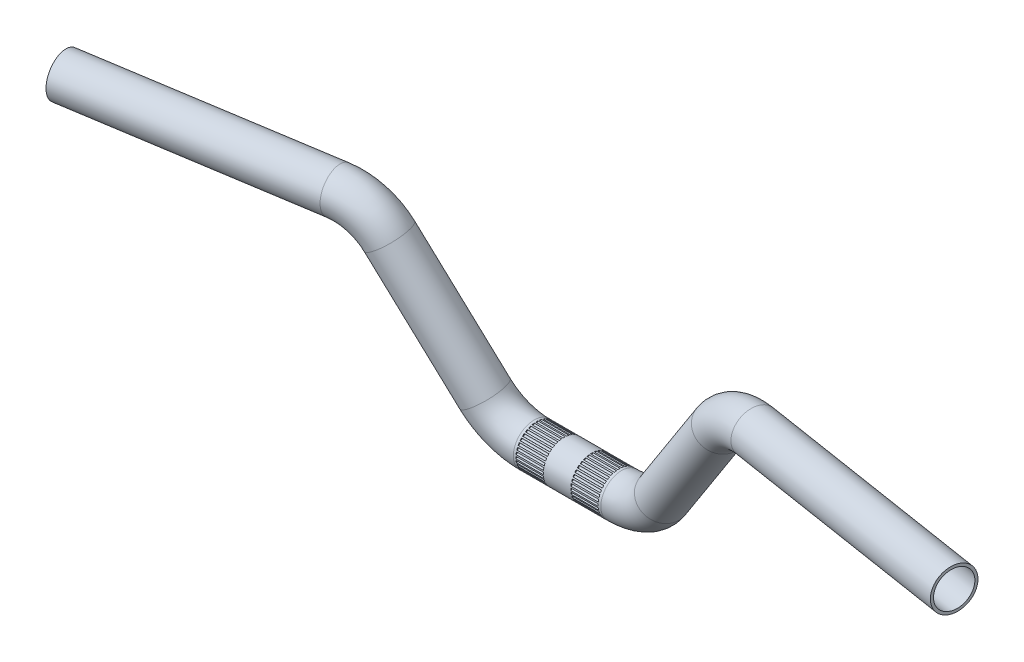
from build123d import *

# Parameters (mm, degrees)
SKETCH3_R                = 19
SKETCH3_R_2              = 16.5
CUT_EXTRUDE3_START       = -12.5
SKETCH4_R                = 1
CUT_EXTRUDE3_DEPTH       = 25
CIRPATTERN2_COUNT        = 36
MIRROR3_START            = -12.5
MIRROR3_COPY_1_SKETCH_R  = 1
MIRROR3_COPY_1_DEPTH     = 25
MIRROR3_COPY_2_SKETCH_R  = 1
MIRROR3_COPY_2_DEPTH     = 25
MIRROR3_COPY_3_SKETCH_R  = 1
MIRROR3_COPY_3_DEPTH     = 25
MIRROR3_COPY_4_SKETCH_R  = 1
MIRROR3_COPY_4_DEPTH     = 25
MIRROR3_COPY_5_SKETCH_R  = 1
MIRROR3_COPY_5_DEPTH     = 25
MIRROR3_COPY_6_SKETCH_R  = 1
MIRROR3_COPY_6_DEPTH     = 25
MIRROR3_COPY_7_SKETCH_R  = 1
MIRROR3_COPY_7_DEPTH     = 25
MIRROR3_COPY_8_SKETCH_R  = 1
MIRROR3_COPY_8_DEPTH     = 25
MIRROR3_COPY_9_SKETCH_R  = 1
MIRROR3_COPY_9_DEPTH     = 25
MIRROR3_COPY_10_SKETCH_R = 1
MIRROR3_COPY_10_DEPTH    = 25
MIRROR3_COPY_11_SKETCH_R = 1
MIRROR3_COPY_11_DEPTH    = 25
MIRROR3_COPY_12_SKETCH_R = 1
MIRROR3_COPY_12_DEPTH    = 25
MIRROR3_COPY_13_SKETCH_R = 1
MIRROR3_COPY_13_DEPTH    = 25
MIRROR3_COPY_14_SKETCH_R = 1
MIRROR3_COPY_14_DEPTH    = 25
MIRROR3_COPY_15_SKETCH_R = 1
MIRROR3_COPY_15_DEPTH    = 25
MIRROR3_COPY_16_SKETCH_R = 1
MIRROR3_COPY_16_DEPTH    = 25
MIRROR3_COPY_17_SKETCH_R = 1
MIRROR3_COPY_17_DEPTH    = 25
MIRROR3_COPY_18_SKETCH_R = 1
MIRROR3_COPY_18_DEPTH    = 25
MIRROR3_COPY_19_SKETCH_R = 1
MIRROR3_COPY_19_DEPTH    = 25
MIRROR3_COPY_20_SKETCH_R = 1
MIRROR3_COPY_20_DEPTH    = 25
MIRROR3_COPY_21_SKETCH_R = 1
MIRROR3_COPY_21_DEPTH    = 25
MIRROR3_COPY_22_SKETCH_R = 1
MIRROR3_COPY_22_DEPTH    = 25
MIRROR3_COPY_23_SKETCH_R = 1
MIRROR3_COPY_23_DEPTH    = 25
MIRROR3_COPY_24_SKETCH_R = 1
MIRROR3_COPY_24_DEPTH    = 25
MIRROR3_COPY_25_SKETCH_R = 1
MIRROR3_COPY_25_DEPTH    = 25
MIRROR3_COPY_26_SKETCH_R = 1
MIRROR3_COPY_26_DEPTH    = 25
MIRROR3_COPY_27_SKETCH_R = 1
MIRROR3_COPY_27_DEPTH    = 25
MIRROR3_COPY_28_SKETCH_R = 1
MIRROR3_COPY_28_DEPTH    = 25
MIRROR3_COPY_29_SKETCH_R = 1
MIRROR3_COPY_29_DEPTH    = 25
MIRROR3_COPY_30_SKETCH_R = 1
MIRROR3_COPY_30_DEPTH    = 25
MIRROR3_COPY_31_SKETCH_R = 1
MIRROR3_COPY_31_DEPTH    = 25
MIRROR3_COPY_32_SKETCH_R = 1
MIRROR3_COPY_32_DEPTH    = 25
MIRROR3_COPY_33_SKETCH_R = 1
MIRROR3_COPY_33_DEPTH    = 25
MIRROR3_COPY_34_SKETCH_R = 1
MIRROR3_COPY_34_DEPTH    = 25
MIRROR3_COPY_35_SKETCH_R = 1
MIRROR3_COPY_35_DEPTH    = 25


with BuildPart() as part:
    # Sweep-Thin1: sweep along a curve in space
    with BuildLine() as sweep_thin1_path:
        Line((0, 0, 0), (39.884500544, 0, 0))
        ThreePointArc((39.884500544, 0, 0), (63.032685027, 5.592668617, 0.998690824), (80.920548564, 21.099765646, 3.767815294))
        Line((80.920548564, 21.099765646, 3.767815294), (150.423374972, 119.386590869, 21.319034084))
        ThreePointArc((150.423374972, 119.386590869, 21.319034084), (167.809892644, 134.548845397, 25.07743527), (190.202166017, 140, 28.973785513))
        Line((190.202166017, 140, 28.973785513), (406, 140, 63))
    # Sketch3 → Sweep-Thin1 (sweep)
    with BuildSketch(Plane(origin=(0, 0, 0), x_dir=(0, 0, -1), z_dir=(1, 0, 0))):
        Circle(SKETCH3_R)
        Circle(SKETCH3_R_2, mode=Mode.SUBTRACT)
    sweep_thin1 = sweep(path=sweep_thin1_path.line)

    # Mirror1: Sweep-Thin1 across plane
    add(sweep_thin1.mirror(Plane(origin=(0, 0, 0), x_dir=(0, 0, 1), z_dir=(1, 0, 0))))

    # Sketch4 → Cut-Extrude3 (cut)
    with BuildSketch(Plane(origin=(0, 0, 0), x_dir=(0, 0, -1), z_dir=(1, 0, 0)).offset(CUT_EXTRUDE3_START)):
        with Locations((0, -19)):
            Circle(SKETCH4_R)
    cut_extrude3 = extrude(amount=-CUT_EXTRUDE3_DEPTH, mode=Mode.SUBTRACT)

    # CirPattern2: Cut-Extrude3 ×36 about axis
    cirpattern2_axis = Axis((0, 0, 0), (1, 0, 0))
    for i in range(1, CIRPATTERN2_COUNT):
        add(cut_extrude3.rotate(cirpattern2_axis, i * 360 / CIRPATTERN2_COUNT), mode=Mode.SUBTRACT)

    # Mirror3: Cut-Extrude3 across plane
    add(cut_extrude3.mirror(Plane(origin=(0, 0, 0), x_dir=(0, 0, 1), z_dir=(1, 0, 0))), mode=Mode.SUBTRACT)

    # Mirror3 copy 1 sketch → Mirror3 copy 1 (cut)
    with BuildSketch(Plane(origin=(0, 0, 0), x_dir=(0, 0.17364817766693033, -0.984807753012208), z_dir=(-1, 0, 0)).offset(MIRROR3_START)):
        with Locations((0, 19)):
            Circle(MIRROR3_COPY_1_SKETCH_R)
    extrude(amount=-MIRROR3_COPY_1_DEPTH, mode=Mode.SUBTRACT)

    # Mirror3 copy 2 sketch → Mirror3 copy 2 (cut)
    with BuildSketch(Plane(origin=(0, 0, 0), x_dir=(0, 0.3420201433256687, -0.9396926207859084), z_dir=(-1, 0, 0)).offset(MIRROR3_START)):
        with Locations((0, 19)):
            Circle(MIRROR3_COPY_2_SKETCH_R)
    extrude(amount=-MIRROR3_COPY_2_DEPTH, mode=Mode.SUBTRACT)

    # Mirror3 copy 3 sketch → Mirror3 copy 3 (cut)
    with BuildSketch(Plane(origin=(0, 0, 0), x_dir=(0, 0.49999999999999994, -0.8660254037844387), z_dir=(-1, 0, 0)).offset(MIRROR3_START)):
        with Locations((0, 19)):
            Circle(MIRROR3_COPY_3_SKETCH_R)
    extrude(amount=-MIRROR3_COPY_3_DEPTH, mode=Mode.SUBTRACT)

    # Mirror3 copy 4 sketch → Mirror3 copy 4 (cut)
    with BuildSketch(Plane(origin=(0, 0, 0), x_dir=(0, 0.6427876096865393, -0.766044443118978), z_dir=(-1, 0, 0)).offset(MIRROR3_START)):
        with Locations((0, 19)):
            Circle(MIRROR3_COPY_4_SKETCH_R)
    extrude(amount=-MIRROR3_COPY_4_DEPTH, mode=Mode.SUBTRACT)

    # Mirror3 copy 5 sketch → Mirror3 copy 5 (cut)
    with BuildSketch(Plane(origin=(0, 0, 0), x_dir=(0, 0.766044443118978, -0.6427876096865394), z_dir=(-1, 0, 0)).offset(MIRROR3_START)):
        with Locations((0, 19)):
            Circle(MIRROR3_COPY_5_SKETCH_R)
    extrude(amount=-MIRROR3_COPY_5_DEPTH, mode=Mode.SUBTRACT)

    # Mirror3 copy 6 sketch → Mirror3 copy 6 (cut)
    with BuildSketch(Plane(origin=(0, 0, 0), x_dir=(0, 0.8660254037844386, -0.5000000000000001), z_dir=(-1, 0, 0)).offset(MIRROR3_START)):
        with Locations((0, 19)):
            Circle(MIRROR3_COPY_6_SKETCH_R)
    extrude(amount=-MIRROR3_COPY_6_DEPTH, mode=Mode.SUBTRACT)

    # Mirror3 copy 7 sketch → Mirror3 copy 7 (cut)
    with BuildSketch(Plane(origin=(0, 0, 0), x_dir=(0, 0.9396926207859083, -0.3420201433256688), z_dir=(-1, 0, 0)).offset(MIRROR3_START)):
        with Locations((0, 19)):
            Circle(MIRROR3_COPY_7_SKETCH_R)
    extrude(amount=-MIRROR3_COPY_7_DEPTH, mode=Mode.SUBTRACT)

    # Mirror3 copy 8 sketch → Mirror3 copy 8 (cut)
    with BuildSketch(Plane(origin=(0, 0, 0), x_dir=(0, 0.984807753012208, -0.17364817766693041), z_dir=(-1, 0, 0)).offset(MIRROR3_START)):
        with Locations((0, 19)):
            Circle(MIRROR3_COPY_8_SKETCH_R)
    extrude(amount=-MIRROR3_COPY_8_DEPTH, mode=Mode.SUBTRACT)

    # Mirror3 copy 9 sketch → Mirror3 copy 9 (cut)
    with BuildSketch(Plane(origin=(0, 0, 0), x_dir=(0, 1, 0), z_dir=(-1, 0, 0)).offset(MIRROR3_START)):
        with Locations((0, 19)):
            Circle(MIRROR3_COPY_9_SKETCH_R)
    extrude(amount=-MIRROR3_COPY_9_DEPTH, mode=Mode.SUBTRACT)

    # Mirror3 copy 10 sketch → Mirror3 copy 10 (cut)
    with BuildSketch(Plane(origin=(0, 0, 0), x_dir=(0, 0.984807753012208, 0.1736481776669303), z_dir=(-1, 0, 0)).offset(MIRROR3_START)):
        with Locations((0, 19)):
            Circle(MIRROR3_COPY_10_SKETCH_R)
    extrude(amount=-MIRROR3_COPY_10_DEPTH, mode=Mode.SUBTRACT)

    # Mirror3 copy 11 sketch → Mirror3 copy 11 (cut)
    with BuildSketch(Plane(origin=(0, 0, 0), x_dir=(0, 0.9396926207859084, 0.3420201433256687), z_dir=(-1, 0, 0)).offset(MIRROR3_START)):
        with Locations((0, 19)):
            Circle(MIRROR3_COPY_11_SKETCH_R)
    extrude(amount=-MIRROR3_COPY_11_DEPTH, mode=Mode.SUBTRACT)

    # Mirror3 copy 12 sketch → Mirror3 copy 12 (cut)
    with BuildSketch(Plane(origin=(0, 0, 0), x_dir=(0, 0.8660254037844387, 0.4999999999999998), z_dir=(-1, 0, 0)).offset(MIRROR3_START)):
        with Locations((0, 19)):
            Circle(MIRROR3_COPY_12_SKETCH_R)
    extrude(amount=-MIRROR3_COPY_12_DEPTH, mode=Mode.SUBTRACT)

    # Mirror3 copy 13 sketch → Mirror3 copy 13 (cut)
    with BuildSketch(Plane(origin=(0, 0, 0), x_dir=(0, 0.766044443118978, 0.6427876096865394), z_dir=(-1, 0, 0)).offset(MIRROR3_START)):
        with Locations((0, 19)):
            Circle(MIRROR3_COPY_13_SKETCH_R)
    extrude(amount=-MIRROR3_COPY_13_DEPTH, mode=Mode.SUBTRACT)

    # Mirror3 copy 14 sketch → Mirror3 copy 14 (cut)
    with BuildSketch(Plane(origin=(0, 0, 0), x_dir=(0, 0.6427876096865395, 0.7660444431189779), z_dir=(-1, 0, 0)).offset(MIRROR3_START)):
        with Locations((0, 19)):
            Circle(MIRROR3_COPY_14_SKETCH_R)
    extrude(amount=-MIRROR3_COPY_14_DEPTH, mode=Mode.SUBTRACT)

    # Mirror3 copy 15 sketch → Mirror3 copy 15 (cut)
    with BuildSketch(Plane(origin=(0, 0, 0), x_dir=(0, 0.49999999999999994, 0.8660254037844387), z_dir=(-1, 0, 0)).offset(MIRROR3_START)):
        with Locations((0, 19)):
            Circle(MIRROR3_COPY_15_SKETCH_R)
    extrude(amount=-MIRROR3_COPY_15_DEPTH, mode=Mode.SUBTRACT)

    # Mirror3 copy 16 sketch → Mirror3 copy 16 (cut)
    with BuildSketch(Plane(origin=(0, 0, 0), x_dir=(0, 0.3420201433256689, 0.9396926207859083), z_dir=(-1, 0, 0)).offset(MIRROR3_START)):
        with Locations((0, 19)):
            Circle(MIRROR3_COPY_16_SKETCH_R)
    extrude(amount=-MIRROR3_COPY_16_DEPTH, mode=Mode.SUBTRACT)

    # Mirror3 copy 17 sketch → Mirror3 copy 17 (cut)
    with BuildSketch(Plane(origin=(0, 0, 0), x_dir=(0, 0.17364817766693028, 0.984807753012208), z_dir=(-1, 0, 0)).offset(MIRROR3_START)):
        with Locations((0, 19)):
            Circle(MIRROR3_COPY_17_SKETCH_R)
    extrude(amount=-MIRROR3_COPY_17_DEPTH, mode=Mode.SUBTRACT)

    # Mirror3 copy 18 sketch → Mirror3 copy 18 (cut)
    with BuildSketch(Plane.ZY.offset(MIRROR3_START)):
        with Locations((0, 19)):
            Circle(MIRROR3_COPY_18_SKETCH_R)
    extrude(amount=-MIRROR3_COPY_18_DEPTH, mode=Mode.SUBTRACT)

    # Mirror3 copy 19 sketch → Mirror3 copy 19 (cut)
    with BuildSketch(Plane(origin=(0, 0, 0), x_dir=(0, -0.17364817766693047, 0.984807753012208), z_dir=(-1, 0, 0)).offset(MIRROR3_START)):
        with Locations((0, 19)):
            Circle(MIRROR3_COPY_19_SKETCH_R)
    extrude(amount=-MIRROR3_COPY_19_DEPTH, mode=Mode.SUBTRACT)

    # Mirror3 copy 20 sketch → Mirror3 copy 20 (cut)
    with BuildSketch(Plane(origin=(0, 0, 0), x_dir=(0, -0.34202014332566866, 0.9396926207859084), z_dir=(-1, 0, 0)).offset(MIRROR3_START)):
        with Locations((0, 19)):
            Circle(MIRROR3_COPY_20_SKETCH_R)
    extrude(amount=-MIRROR3_COPY_20_DEPTH, mode=Mode.SUBTRACT)

    # Mirror3 copy 21 sketch → Mirror3 copy 21 (cut)
    with BuildSketch(Plane(origin=(0, 0, 0), x_dir=(0, -0.5000000000000001, 0.8660254037844386), z_dir=(-1, 0, 0)).offset(MIRROR3_START)):
        with Locations((0, 19)):
            Circle(MIRROR3_COPY_21_SKETCH_R)
    extrude(amount=-MIRROR3_COPY_21_DEPTH, mode=Mode.SUBTRACT)

    # Mirror3 copy 22 sketch → Mirror3 copy 22 (cut)
    with BuildSketch(Plane(origin=(0, 0, 0), x_dir=(0, -0.6427876096865393, 0.766044443118978), z_dir=(-1, 0, 0)).offset(MIRROR3_START)):
        with Locations((0, 19)):
            Circle(MIRROR3_COPY_22_SKETCH_R)
    extrude(amount=-MIRROR3_COPY_22_DEPTH, mode=Mode.SUBTRACT)

    # Mirror3 copy 23 sketch → Mirror3 copy 23 (cut)
    with BuildSketch(Plane(origin=(0, 0, 0), x_dir=(0, -0.7660444431189779, 0.6427876096865395), z_dir=(-1, 0, 0)).offset(MIRROR3_START)):
        with Locations((0, 19)):
            Circle(MIRROR3_COPY_23_SKETCH_R)
    extrude(amount=-MIRROR3_COPY_23_DEPTH, mode=Mode.SUBTRACT)

    # Mirror3 copy 24 sketch → Mirror3 copy 24 (cut)
    with BuildSketch(Plane(origin=(0, 0, 0), x_dir=(0, -0.8660254037844384, 0.5000000000000004), z_dir=(-1, 0, 0)).offset(MIRROR3_START)):
        with Locations((0, 19)):
            Circle(MIRROR3_COPY_24_SKETCH_R)
    extrude(amount=-MIRROR3_COPY_24_DEPTH, mode=Mode.SUBTRACT)

    # Mirror3 copy 25 sketch → Mirror3 copy 25 (cut)
    with BuildSketch(Plane(origin=(0, 0, 0), x_dir=(0, -0.9396926207859084, 0.34202014332566855), z_dir=(-1, 0, 0)).offset(MIRROR3_START)):
        with Locations((0, 19)):
            Circle(MIRROR3_COPY_25_SKETCH_R)
    extrude(amount=-MIRROR3_COPY_25_DEPTH, mode=Mode.SUBTRACT)

    # Mirror3 copy 26 sketch → Mirror3 copy 26 (cut)
    with BuildSketch(Plane(origin=(0, 0, 0), x_dir=(0, -0.984807753012208, 0.17364817766693033), z_dir=(-1, 0, 0)).offset(MIRROR3_START)):
        with Locations((0, 19)):
            Circle(MIRROR3_COPY_26_SKETCH_R)
    extrude(amount=-MIRROR3_COPY_26_DEPTH, mode=Mode.SUBTRACT)

    # Mirror3 copy 27 sketch → Mirror3 copy 27 (cut)
    with BuildSketch(Plane(origin=(0, 0, 0), x_dir=(0, -1, 0), z_dir=(-1, 0, 0)).offset(MIRROR3_START)):
        with Locations((0, 19)):
            Circle(MIRROR3_COPY_27_SKETCH_R)
    extrude(amount=-MIRROR3_COPY_27_DEPTH, mode=Mode.SUBTRACT)

    # Mirror3 copy 28 sketch → Mirror3 copy 28 (cut)
    with BuildSketch(Plane(origin=(0, 0, 0), x_dir=(0, -0.9848077530122081, -0.17364817766692997), z_dir=(-1, 0, 0)).offset(MIRROR3_START)):
        with Locations((0, 19)):
            Circle(MIRROR3_COPY_28_SKETCH_R)
    extrude(amount=-MIRROR3_COPY_28_DEPTH, mode=Mode.SUBTRACT)

    # Mirror3 copy 29 sketch → Mirror3 copy 29 (cut)
    with BuildSketch(Plane(origin=(0, 0, 0), x_dir=(0, -0.9396926207859083, -0.342020143325669), z_dir=(-1, 0, 0)).offset(MIRROR3_START)):
        with Locations((0, 19)):
            Circle(MIRROR3_COPY_29_SKETCH_R)
    extrude(amount=-MIRROR3_COPY_29_DEPTH, mode=Mode.SUBTRACT)

    # Mirror3 copy 30 sketch → Mirror3 copy 30 (cut)
    with BuildSketch(Plane(origin=(0, 0, 0), x_dir=(0, -0.8660254037844386, -0.5000000000000001), z_dir=(-1, 0, 0)).offset(MIRROR3_START)):
        with Locations((0, 19)):
            Circle(MIRROR3_COPY_30_SKETCH_R)
    extrude(amount=-MIRROR3_COPY_30_DEPTH, mode=Mode.SUBTRACT)

    # Mirror3 copy 31 sketch → Mirror3 copy 31 (cut)
    with BuildSketch(Plane(origin=(0, 0, 0), x_dir=(0, -0.7660444431189781, -0.6427876096865393), z_dir=(-1, 0, 0)).offset(MIRROR3_START)):
        with Locations((0, 19)):
            Circle(MIRROR3_COPY_31_SKETCH_R)
    extrude(amount=-MIRROR3_COPY_31_DEPTH, mode=Mode.SUBTRACT)

    # Mirror3 copy 32 sketch → Mirror3 copy 32 (cut)
    with BuildSketch(Plane(origin=(0, 0, 0), x_dir=(0, -0.6427876096865396, -0.7660444431189778), z_dir=(-1, 0, 0)).offset(MIRROR3_START)):
        with Locations((0, 19)):
            Circle(MIRROR3_COPY_32_SKETCH_R)
    extrude(amount=-MIRROR3_COPY_32_DEPTH, mode=Mode.SUBTRACT)

    # Mirror3 copy 33 sketch → Mirror3 copy 33 (cut)
    with BuildSketch(Plane(origin=(0, 0, 0), x_dir=(0, -0.5000000000000004, -0.8660254037844384), z_dir=(-1, 0, 0)).offset(MIRROR3_START)):
        with Locations((0, 19)):
            Circle(MIRROR3_COPY_33_SKETCH_R)
    extrude(amount=-MIRROR3_COPY_33_DEPTH, mode=Mode.SUBTRACT)

    # Mirror3 copy 34 sketch → Mirror3 copy 34 (cut)
    with BuildSketch(Plane(origin=(0, 0, 0), x_dir=(0, -0.3420201433256686, -0.9396926207859084), z_dir=(-1, 0, 0)).offset(MIRROR3_START)):
        with Locations((0, 19)):
            Circle(MIRROR3_COPY_34_SKETCH_R)
    extrude(amount=-MIRROR3_COPY_34_DEPTH, mode=Mode.SUBTRACT)

    # Mirror3 copy 35 sketch → Mirror3 copy 35 (cut)
    with BuildSketch(Plane(origin=(0, 0, 0), x_dir=(0, -0.1736481776669304, -0.984807753012208), z_dir=(-1, 0, 0)).offset(MIRROR3_START)):
        with Locations((0, 19)):
            Circle(MIRROR3_COPY_35_SKETCH_R)
    extrude(amount=-MIRROR3_COPY_35_DEPTH, mode=Mode.SUBTRACT)


solid = part.part
